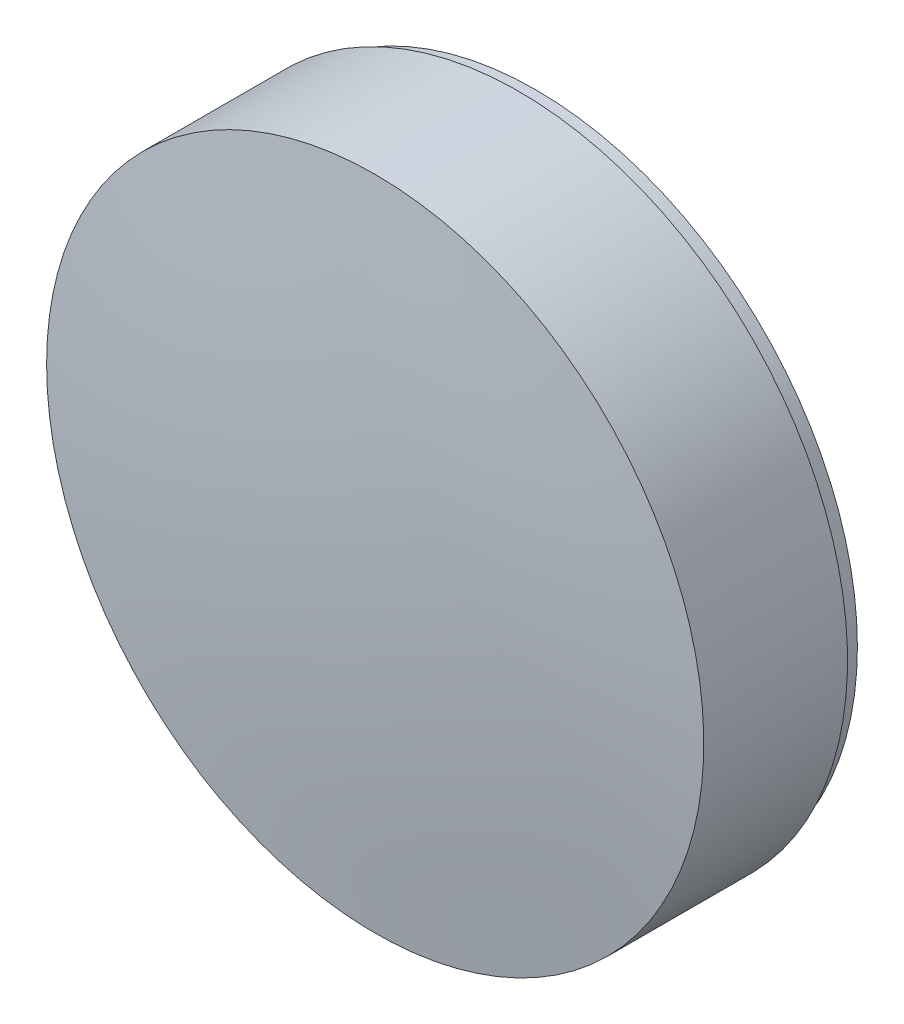
from build123d import *


with BuildPart() as part:
    # Sketch1 → Revolve1 (revolve)
    with BuildSketch(Plane(origin=(0, 0, 0), x_dir=(0, 0, -1), z_dir=(1, 0, 0)), mode=Mode.PRIVATE) as revolve1_sk:
        with BuildLine():
            Line((0, 0), (2.99, 0))
            ThreePointArc((2.99, 0), (2.899808326, 2.28211782), (2.629795913, 4.55))
            Line((2.629795913, 4.55), (2.39, 4.55))
            Line((2.39, 4.55), (2.39, 4.65))
            Line((2.39, 4.65), (0.35637, 4.65))
            add(Edge.make_bspline(
                [(0, 0), (1.0585e-05, 0.016666675), (3.1754e-05, 0.050000082), (0.000172984, 0.100000196), (0.000416313, 0.150000247), (0.000741771, 0.200000393), (0.00117662, 0.250000412), (0.001691776, 0.300000587), (0.002316315, 0.350000583), (0.003023011, 0.40000076), (0.003831708, 0.450000894), (0.004750245, 0.500000688), (0.005727405, 0.550001239), (0.00684027, 0.600000834), (0.008011649, 0.650001266), (0.009293313, 0.700001334), (0.01067531, 0.750001275), (0.01214567, 0.800001341), (0.013702261, 0.850001644), (0.015365589, 0.900001517), (0.0171157, 0.950001587), (0.018951964, 1.000001943), (0.020896861, 1.050001711), (0.022921025, 1.100002178), (0.025059538, 1.150001612), (0.027261298, 1.200002349), (0.029575863, 1.250002083), (0.031975857, 1.300002154), (0.03446136, 1.350002643), (0.037059448, 1.400001958), (0.039721548, 1.450002813), (0.042495217, 1.500002527), (0.045358437, 1.550002215), (0.048291875, 1.600003075), (0.051335098, 1.650002776), (0.054468758, 1.7000024), (0.057670873, 1.750003421), (0.060988964, 1.800002529), (0.064374387, 1.85000313), (0.067854739, 1.900003194), (0.071427974, 1.950002793), (0.075074642, 2.00000335), (0.078814906, 2.050003415), (0.082647252, 2.100003052), (0.086557534, 2.150003089), (0.09054412, 2.200003703), (0.094627689, 2.250003213), (0.098786764, 2.300003351), (0.103026935, 2.350003402), (0.107347243, 2.400003436), (0.111745903, 2.450003623), (0.116230995, 2.500002917), (0.120771898, 2.550004422), (0.125423536, 2.600002475), (0.130115659, 2.650003882), (0.134895907, 2.700003934), (0.139762863, 2.750002653), (0.144674474, 2.800004184), (0.149681451, 2.850002876), (0.154741593, 2.900002887), (0.159854091, 2.950004395), (0.165064395, 3.000002331), (0.170310094, 3.050003154), (0.175617215, 3.100003863), (0.181003305, 3.150002527), (0.186431372, 3.200002759), (0.19191297, 3.250002608), (0.197438586, 3.300003494), (0.203034761, 3.350002086), (0.208663943, 3.40000219), (0.214331023, 3.450002921), (0.220053799, 3.500002244), (0.22581534, 3.550001694), (0.231606071, 3.600001616), (0.237421619, 3.650002537), (0.243288933, 3.700000908), (0.249163602, 3.750001933), (0.255077802, 3.80000105), (0.261006064, 3.85000126), (0.266958731, 3.900000549), (0.272919479, 3.950000459), (0.278883821, 4.000001537), (0.284885897, 4.049998895), (0.290852452, 4.100001703), (0.296864862, 4.149999018), (0.302847864, 4.200000256), (0.308843588, 4.249999172), (0.314817453, 4.300000304), (0.320806458, 4.349998433), (0.326756057, 4.40000047), (0.332729079, 4.449997731), (0.33864665, 4.500000398), (0.344584088, 4.549998725), (0.350496215, 4.599998089), (0.354412117, 4.633333084), (0.35637, 4.65)],
                knots=[0, 0, 0, 0, 0.010713494, 0.021427024, 0.032140636, 0.042854358, 0.053568243, 0.064282311, 0.074996623, 0.085711192, 0.096426086, 0.107141349, 0.117856937, 0.128573018, 0.13928949, 0.150006489, 0.160724057, 0.171442175, 0.182160876, 0.192880268, 0.203600316, 0.214321057, 0.225042607, 0.235764921, 0.246488127, 0.257212075, 0.267936991, 0.278662815, 0.28938958, 0.300117432, 0.310846185, 0.321576102, 0.332307103, 0.343039096, 0.353772368, 0.364506828, 0.375242372, 0.385979311, 0.396717395, 0.407456801, 0.418197564, 0.42893956, 0.439682978, 0.450427852, 0.461174048, 0.471921595, 0.482670692, 0.493421198, 0.504173138, 0.51492654, 0.525681431, 0.536437839, 0.547195595, 0.557955116, 0.568715833, 0.579478167, 0.590242146, 0.601007377, 0.6117743, 0.622542509, 0.633312021, 0.644083292, 0.654855677, 0.665629412, 0.676404741, 0.687181222, 0.697958864, 0.708737679, 0.719517915, 0.730299107, 0.741081261, 0.751864627, 0.762648971, 0.773434052, 0.784219875, 0.795006692, 0.805794008, 0.816582078, 0.827370651, 0.83815973, 0.848949062, 0.859738648, 0.870528743, 0.881318583, 0.892108933, 0.902899028, 0.913689123, 0.924478963, 0.935268803, 0.946058135, 0.956847468, 0.967636041, 0.978424614, 0.989212683, 1, 1, 1, 1], degree=3))
        make_face()
    revolve(revolve1_sk.sketch.rotate(Axis((0, 0, -3.364551637), (0, 0, 1)), 90), axis=Axis((0, 0, -3.364551637), (0, 0, 1)))


solid = part.part
